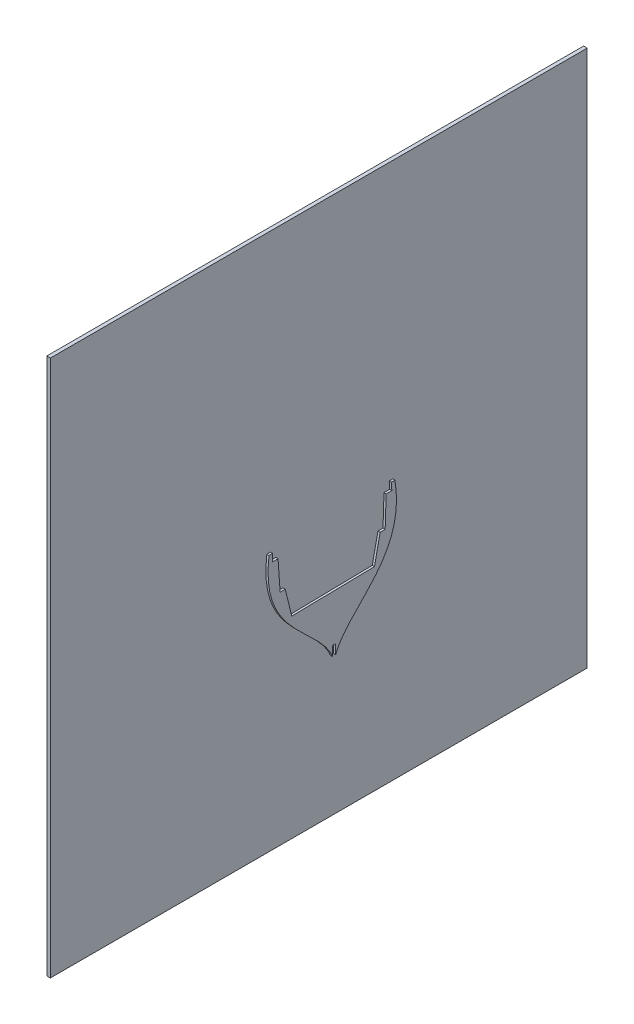
from build123d import *

# Parameters (mm, degrees)
BOSS_EXTRU_2_DEPTH      = 10
BOSS_EXTRU_3_DEPTH      = 6
ENL_V_MAT_EXTRU_1_DEPTH = 6


with BuildPart() as part:
    # Esquisse3D1 → Boss.-Extru.2 (new body)
    with BuildSketch(Plane(origin=(-20, 1121.289346724, 777.274991403), x_dir=(0, -0.7071067811865476, -0.7071067811865476), z_dir=(1, 0, 0))):
        Polygon((0, 0), (1060.66017178, 1060.66017178), (2121.32034356, 0), (1060.66017178, -1060.66017178), align=None)
    extrude(amount=BOSS_EXTRU_2_DEPTH)


with BuildPart() as body_2:
    # Esquisse5 → Boss.-Extru.3 (new body)
    with BuildSketch(Plane(origin=(0, 0, 0), x_dir=(0, 0, -1), z_dir=(1, 0, 0))):
        with BuildLine():
            Line((169.498883348, 360.518503443), (159.498883348, 360.337349671))
            Line((159.498883348, 360.337349671), (160.767859708, 339.756849085))
            Line((160.767859708, 339.756849085), (144.923491305, 339.469822374))
            Line((144.923491305, 339.469822374), (142.15251138, 255.19639745))
            Line((142.15251138, 255.19639745), (127.994738238, 254.939924049))
            Line((127.994738238, 254.939924049), (112.299120278, 179.892571395))
            Line((112.299120278, 179.892571395), (-118.74094417, 175.707193466))
            Line((-118.74094417, 175.707193466), (-137.144394156, 250.13682864))
            Line((-137.144394156, 250.13682864), (-151.302167298, 249.880355239))
            Line((-151.302167298, 249.880355239), (-157.123617242, 333.998125053))
            Line((-157.123617242, 333.998125053), (-172.967985645, 333.711098342))
            Line((-172.967985645, 333.711098342), (-172.445244332, 354.32405657))
            Line((-172.445244332, 354.32405657), (-182.445244332, 354.142902797))
            add(Edge.make_bspline(
                [(0, 0), (-0.284058759, 15.680532332), (-16.394807679, 119.589146317), (-211.353019639, 127.075372846), (-182.445244332, 354.142902797)],
                knots=[0, 0, 0, 0, 0, 1, 1, 1, 1, 1], degree=4))
            add(Edge.make_bspline(
                [(0, 0), (-0.284058759, 15.680532332), (12.052667157, 120.104483055), (206.611820778, 134.64696361), (169.498883348, 360.518503443)],
                knots=[0, 0, 0, 0, 0, 1, 1, 1, 1, 1], degree=4))
        make_face()
    extrude(amount=BOSS_EXTRU_3_DEPTH)

    # Esquisse6 → Enlèv. mat.-Extru.1 (cut)
    with BuildSketch(Plane(origin=(6, 0, 0), x_dir=(0, 0, -1), z_dir=(1, 0, 0))):
        Polygon((-4.878315193, 20.802130493), (-5.367430379, 47.802130493), (3.632569621, 47.965168888), (4.121684807, 20.965168888), (117.063261114, -47.52702125), (-85.227699586, -65.220017949), align=None)
    extrude(amount=-ENL_V_MAT_EXTRU_1_DEPTH, mode=Mode.SUBTRACT)


solid = Compound([part.part, body_2.part])
